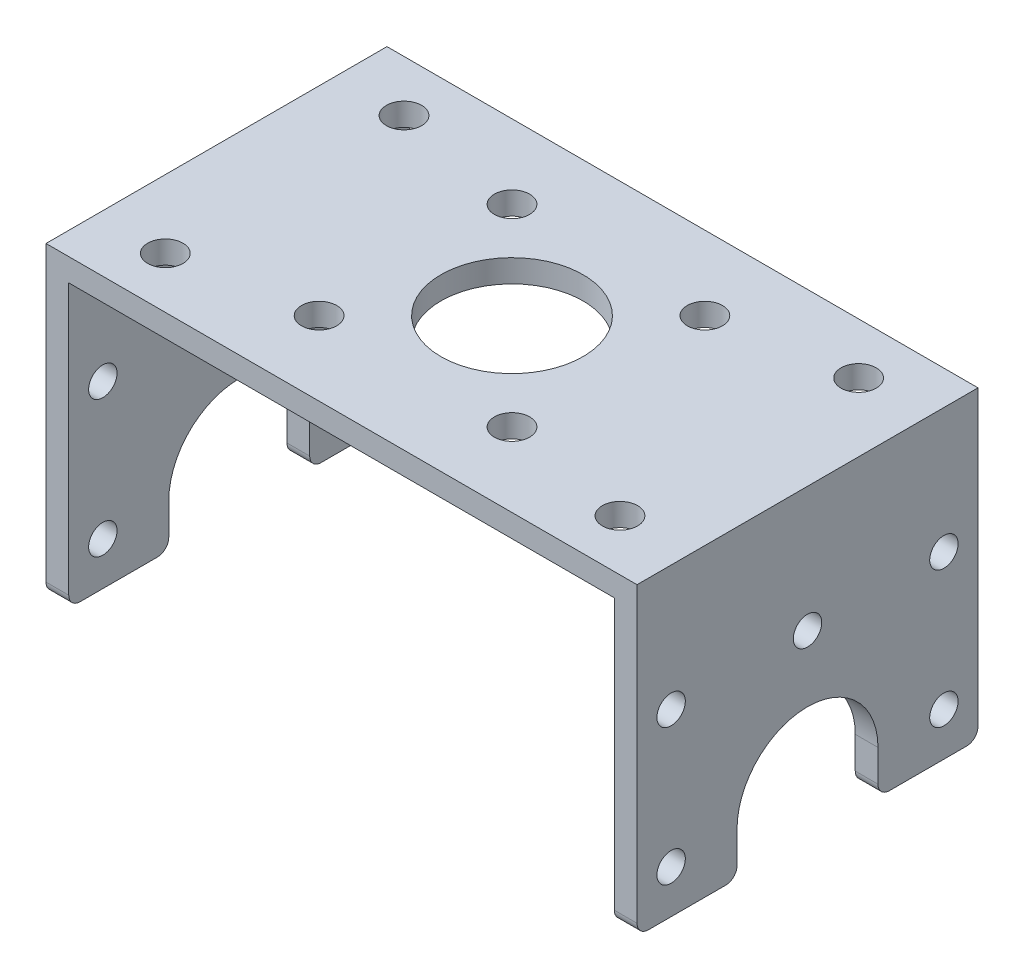
from build123d import *

# Parameters (mm, degrees)
BOSS_EXTRU_1_DEPTH      = 15
ESQUISSE4_R             = 6.25
ESQUISSE4_R_2           = 1.55
ENL_V_MAT_EXTRU_2_DEPTH = 41.239781312
ESQUISSE2_R             = 1.25
ENL_V_MAT_EXTRU_1_DEPTH = 61.392383626
CONG_1_R                = 1


with BuildPart() as part:
    # Esquisse1 → Boss.-Extru.1 (new, symmetric)
    with BuildSketch(Plane.XY):
        Polygon((-26, 26.8), (26, 26.8), (26, 0), (24, 0), (24, 24.8), (-24, 24.8), (-24, 0), (-26, 0), align=None)
    extrude(amount=BOSS_EXTRU_1_DEPTH, both=True)

    # Esquisse4 → Enlèv. mat.-Extru.2 (cut, through all)
    with BuildSketch(Plane(origin=(0, 26.8, 0), x_dir=(1, 0, 0), z_dir=(0, 1, 0))):
        with Locations(Location((0, 0, 0), (0, 0, 270))):
            Circle(ESQUISSE4_R)
        with Locations(Location((-8.485281374, 8.485281374, 0), (0, 0, 270))):
            Circle(ESQUISSE4_R_2)
        with Locations(Location((8.485281374, 8.485281374, 0), (0, 0, 270))):
            Circle(ESQUISSE4_R_2)
        with Locations(Location((8.485281374, -8.485281374, 0), (0, 0, 270))):
            Circle(ESQUISSE4_R_2)
        with Locations(Location((-8.485281374, -8.485281374, 0), (0, 0, 270))):
            Circle(ESQUISSE4_R_2)
        with Locations(Location((20, 10.5, 0), (0, 0, 270))):
            Circle(ESQUISSE4_R_2)
        with Locations(Location((-20, 10.5, 0), (0, 0, 270))):
            Circle(ESQUISSE4_R_2)
        with Locations(Location((20, -10.5, 0), (0, 0, 270))):
            Circle(ESQUISSE4_R_2)
        with Locations(Location((-20, -10.5, 0), (0, 0, 270))):
            Circle(ESQUISSE4_R_2)
    extrude(amount=-ENL_V_MAT_EXTRU_2_DEPTH, mode=Mode.SUBTRACT)

    # Esquisse2 → Enlèv. mat.-Extru.1 (cut, through all)
    with BuildSketch(Plane(origin=(26, 0, 0), x_dir=(0, 0, -1), z_dir=(1, 0, 0))):
        with Locations((-12, 15.8)):
            Circle(ESQUISSE2_R)
        with Locations((-12, 3.8)):
            Circle(ESQUISSE2_R)
        with Locations((0, 15.8)):
            Circle(ESQUISSE2_R)
        with Locations((12, 3.8)):
            Circle(ESQUISSE2_R)
        with Locations((12, 15.8)):
            Circle(ESQUISSE2_R)
        with BuildLine():
            Line((-6.2, 3.8), (-6.2, 0))
            Line((-6.2, 0), (6.2, 0))
            Line((6.2, 0), (6.2, 3.8))
            ThreePointArc((6.2, 3.8), (0, 10), (-6.2, 3.8))
        make_face()
    extrude(amount=-ENL_V_MAT_EXTRU_1_DEPTH, mode=Mode.SUBTRACT)

    # Congé1
    cong_1_edges = [part.edges().sort_by_distance(p)[0] for p in [
        (-25, 0, -6.2),
        (25, 0, -6.2),
        (-25, 0, 6.2),
        (25, 0, 6.2),
        (25, 0, 15),
        (-25, 0, 15),
        (-25, 0, -15),
        (25, 0, -15),
    ]]
    fillet(cong_1_edges, radius=CONG_1_R)


solid = part.part
